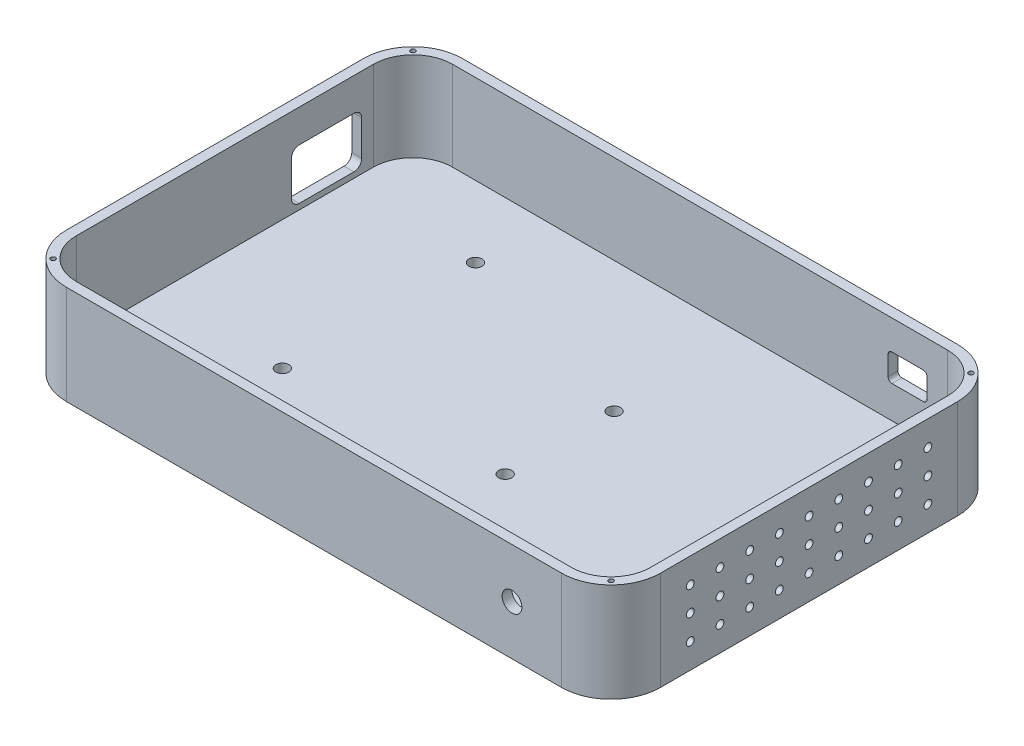
from build123d import *

# Parameters (mm, degrees)
BOSS_EXTRUDE1_DEPTH = 25.4
CUT_EXTRUDE6_DEPTH  = 22.86
SKETCH7_R           = 0.6
CUT_EXTRUDE8_DEPTH  = 2.46
CUT_EXTRUDE9_DEPTH  = 10
SKETCH12_R          = 1
CUT_EXTRUDE10_DEPTH = 10
CUT_EXTRUDE12_DEPTH = 10
SKETCH14_R          = 1.663741232
CUT_EXTRUDE13_DEPTH = 95.390993214
SKETCH15_R          = 1.925
CUT_EXTRUDE14_DEPTH = 95.390993214
SKETCH16_R          = 2.54
CUT_EXTRUDE15_DEPTH = 5.08


with BuildPart() as part:
    # Sketch1 → Boss-Extrude1 (new body)
    with BuildSketch(Plane(origin=(0, 0, 0), x_dir=(1, 0, 0), z_dir=(0, 1, 0))):
        with BuildLine():
            Line((63.5, 50.8), (-63.5, 50.8))
            ThreePointArc((-63.5, 50.8), (-72.480256121, 47.080256121), (-76.2, 38.1))
            Line((-76.2, 38.1), (-76.2, -38.1))
            ThreePointArc((-76.2, -38.1), (-72.480256121, -47.080256121), (-63.5, -50.8))
            Line((-63.5, -50.8), (63.5, -50.8))
            ThreePointArc((63.5, -50.8), (72.480256121, -47.080256121), (76.2, -38.1))
            Line((76.2, -38.1), (76.2, 38.1))
            ThreePointArc((76.2, 38.1), (72.480256121, 47.080256121), (63.5, 50.8))
        make_face()
    extrude(amount=BOSS_EXTRUDE1_DEPTH)

    # Sketch4 → Cut-Extrude6 (cut)
    with BuildSketch(Plane(origin=(0, 25.4, 0), x_dir=(1, 0, 0), z_dir=(0, 1, 0))):
        with BuildLine():
            Line((-63.5, 48.26), (63.5, 48.26))
            ThreePointArc((63.5, 48.26), (70.684204897, 45.284204897), (73.66, 38.1))
            Line((73.66, 38.1), (73.66, -38.1))
            ThreePointArc((73.66, -38.1), (70.684204897, -45.284204897), (63.5, -48.26))
            Line((63.5, -48.26), (-63.5, -48.26))
            ThreePointArc((-63.5, -48.26), (-70.684204897, -45.284204897), (-73.66, -38.1))
            Line((-73.66, -38.1), (-73.66, 38.1))
            ThreePointArc((-73.66, 38.1), (-70.684204897, 45.284204897), (-63.5, 48.26))
        make_face()
    extrude(amount=-CUT_EXTRUDE6_DEPTH, mode=Mode.SUBTRACT)

    # Sketch7 → Cut-Extrude8 (cut)
    with BuildSketch(Plane(origin=(0, 25.4, 0), x_dir=(1, 0, 0), z_dir=(0, 1, 0))):
        with Locations(Location((-71.56, 46.16, 0), (0, 0, 270))):
            Circle(SKETCH7_R)
        with Locations(Location((-71.56, -46.16, 0), (0, 0, 270))):
            Circle(SKETCH7_R)
        with Locations(Location((71.56, -46.16, 0), (0, 0, 270))):
            Circle(SKETCH7_R)
        with Locations(Location((71.56, 46.16, 0), (0, 0, 270))):
            Circle(SKETCH7_R)
    extrude(amount=-CUT_EXTRUDE8_DEPTH, mode=Mode.SUBTRACT)

    # Sketch10 → Cut-Extrude9 (cut)
    with BuildSketch(Plane.ZY.offset(76.2)):
        with BuildLine():
            Line((-33.1, 17), (-19.1, 17))
            ThreePointArc((-19.1, 17), (-17.685786438, 16.414213562), (-17.1, 15))
            Line((-17.1, 15), (-17.1, 6))
            ThreePointArc((-17.1, 6), (-17.685786438, 4.585786438), (-19.1, 4))
            Line((-19.1, 4), (-33.1, 4))
            ThreePointArc((-33.1, 4), (-34.514213562, 4.585786438), (-35.1, 6))
            Line((-35.1, 6), (-35.1, 15))
            ThreePointArc((-35.1, 15), (-34.514213562, 16.414213562), (-33.1, 17))
        make_face()
    extrude(amount=-CUT_EXTRUDE9_DEPTH, mode=Mode.SUBTRACT)

    # Sketch12 → Cut-Extrude10 (cut)
    with BuildSketch(Plane(origin=(76.2, 0, 0), x_dir=(0, 0, -1), z_dir=(1, 0, 0))):
        with Locations((-30.48, 19)):
            Circle(SKETCH12_R)
        with Locations((-30.48, 12.7)):
            Circle(SKETCH12_R)
        with Locations((-30.48, 6.4)):
            Circle(SKETCH12_R)
        with Locations((-22.86, 19)):
            Circle(SKETCH12_R)
        with Locations((-22.86, 12.7)):
            Circle(SKETCH12_R)
        with Locations((-22.86, 6.4)):
            Circle(SKETCH12_R)
        with Locations((-15.24, 19)):
            Circle(SKETCH12_R)
        with Locations((-15.24, 12.7)):
            Circle(SKETCH12_R)
        with Locations((-15.24, 6.4)):
            Circle(SKETCH12_R)
        with Locations((-7.62, 19)):
            Circle(SKETCH12_R)
        with Locations((-7.62, 12.7)):
            Circle(SKETCH12_R)
        with Locations((-7.62, 6.4)):
            Circle(SKETCH12_R)
        with Locations((0, 19)):
            Circle(SKETCH12_R)
        with Locations((0, 12.7)):
            Circle(SKETCH12_R)
        with Locations((0, 6.4)):
            Circle(SKETCH12_R)
        with Locations((7.62, 19)):
            Circle(SKETCH12_R)
        with Locations((7.62, 12.7)):
            Circle(SKETCH12_R)
        with Locations((7.62, 6.4)):
            Circle(SKETCH12_R)
        with Locations((15.24, 19)):
            Circle(SKETCH12_R)
        with Locations((15.24, 12.7)):
            Circle(SKETCH12_R)
        with Locations((15.24, 6.4)):
            Circle(SKETCH12_R)
        with Locations((22.86, 19)):
            Circle(SKETCH12_R)
        with Locations((22.86, 12.7)):
            Circle(SKETCH12_R)
        with Locations((22.86, 6.4)):
            Circle(SKETCH12_R)
        with Locations((30.48, 19)):
            Circle(SKETCH12_R)
        with Locations((30.48, 12.7)):
            Circle(SKETCH12_R)
        with Locations((30.48, 6.4)):
            Circle(SKETCH12_R)
    extrude(amount=-CUT_EXTRUDE10_DEPTH, mode=Mode.SUBTRACT)

    # Sketch13 → Cut-Extrude12 (cut)
    with BuildSketch(Plane(origin=(0, 0, -50.8), x_dir=(-1, 0, 0), z_dir=(0, 0, -1))):
        with BuildLine():
            Line((-57.2, 17.839671087), (-49.2, 17.839671087))
            ThreePointArc((-49.2, 17.839671087), (-48.492893219, 17.546777868), (-48.2, 16.839671087))
            Line((-48.2, 16.839671087), (-48.2, 11.839671087))
            ThreePointArc((-48.2, 11.839671087), (-48.492893219, 11.132564306), (-49.2, 10.839671087))
            Line((-49.2, 10.839671087), (-57.2, 10.839671087))
            ThreePointArc((-57.2, 10.839671087), (-57.907106781, 11.132564306), (-58.2, 11.839671087))
            Line((-58.2, 11.839671087), (-58.2, 16.839671087))
            ThreePointArc((-58.2, 16.839671087), (-57.907106781, 17.546777868), (-57.2, 17.839671087))
        make_face()
    extrude(amount=-CUT_EXTRUDE12_DEPTH, mode=Mode.SUBTRACT)

    # Sketch14 → Cut-Extrude13 (cut, through all)
    with BuildSketch(Plane(origin=(0, 2.54, 0), x_dir=(1, 0, 0), z_dir=(0, 1, 0))):
        with Locations(Location((-39.37, 30, 0), (0, 0, 270))):
            Circle(SKETCH14_R)
        with Locations(Location((-40.64, -18.26, 0), (0, 0, 270))):
            Circle(SKETCH14_R)
        with Locations(Location((11.43, -13.18, 0), (0, 0, 270))):
            Circle(SKETCH14_R)
        with Locations(Location((11.43, 14.76, 0), (0, 0, 270))):
            Circle(SKETCH14_R)
    extrude(amount=-CUT_EXTRUDE13_DEPTH, mode=Mode.SUBTRACT)

    # Sketch15 → Cut-Extrude14 (cut, through all)
    with BuildSketch(Plane(origin=(0, 2.54, 0), x_dir=(1, 0, 0), z_dir=(0, 1, 0))):
        with Locations(Location((-27.451730326, -37.489635759, 0), (0, 0, 270))):
            Circle(SKETCH15_R)
    extrude(amount=-CUT_EXTRUDE14_DEPTH, mode=Mode.SUBTRACT)

    # Sketch16 → Cut-Extrude15 (cut)
    with BuildSketch(Plane.XY.offset(50.8)):
        with Locations((50.8, 12.7)):
            Circle(SKETCH16_R)
    extrude(amount=-CUT_EXTRUDE15_DEPTH, mode=Mode.SUBTRACT)


solid = part.part
